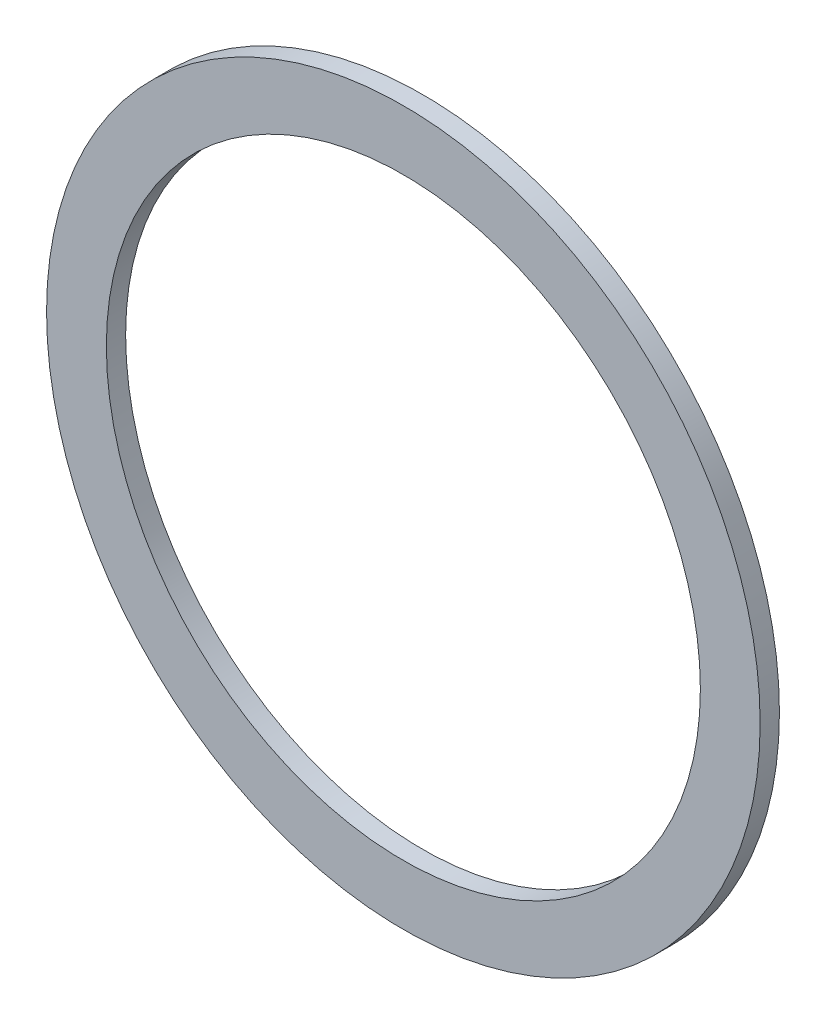
from build123d import *

# Parameters (mm, degrees)
CIRCLIP_ENVELOPE_START = 16.5
SKETCH_1_R             = 18.5
SKETCH_1_R_2           = 15.4
CIRCLIP_ENVELOPE_DEPTH = 1


with BuildPart() as part:
    # Эскиз1 → Circlip_envelope (new body)
    with BuildSketch(Plane.XY.offset(CIRCLIP_ENVELOPE_START)):
        Circle(SKETCH_1_R)
        Circle(SKETCH_1_R_2, mode=Mode.SUBTRACT)
    extrude(amount=CIRCLIP_ENVELOPE_DEPTH)


solid = part.part
